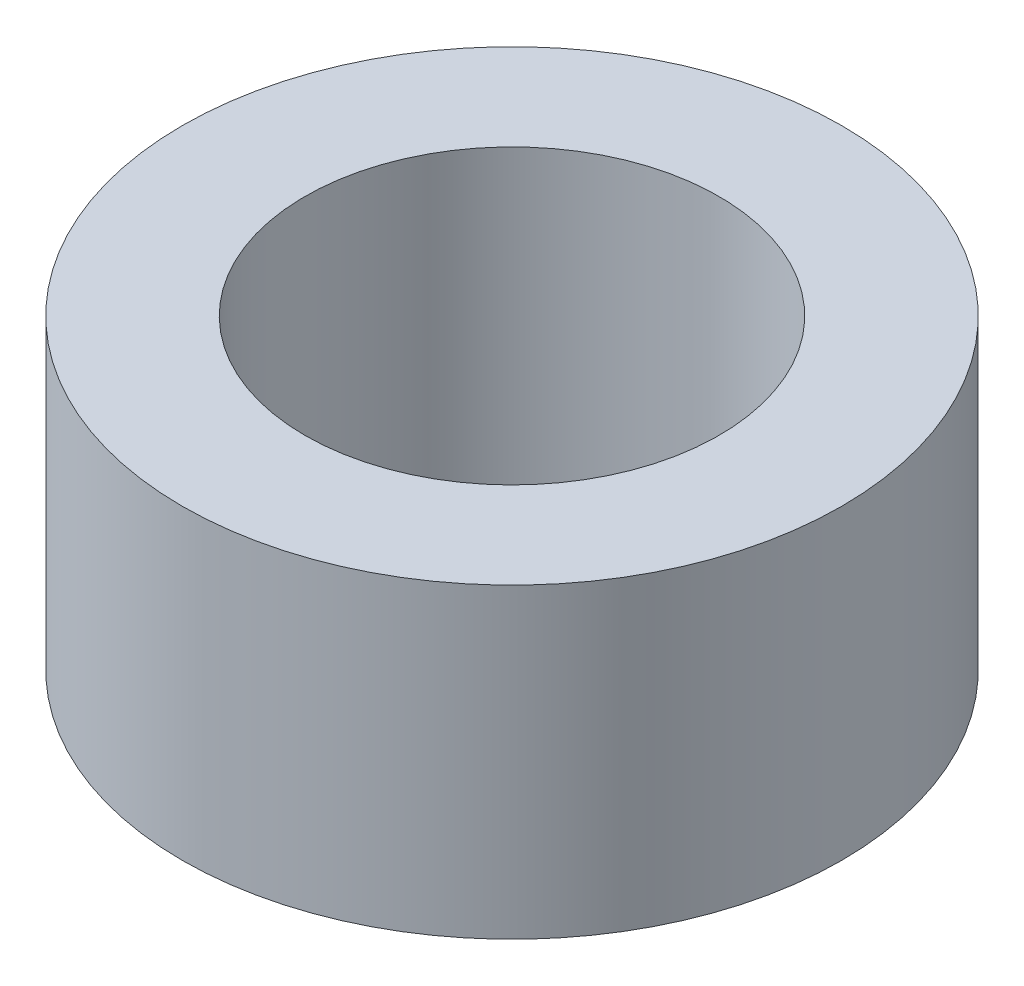
from build123d import *

# Parameters (mm, degrees)
SKETCH1_R           = 5.375
SKETCH1_R_2         = 3.375
BOSS_EXTRUDE1_DEPTH = 5


with BuildPart() as part:
    # Sketch1 → Boss-Extrude1 (new body)
    with BuildSketch(Plane(origin=(0, 0, 0), x_dir=(1, 0, 0), z_dir=(0, 1, 0))):
        with Locations(Location((0, 0, 0), (0, 0, 270))):
            Circle(SKETCH1_R)
        with Locations(Location((0, 0, 0), (0, 0, 270))):
            Circle(SKETCH1_R_2, mode=Mode.SUBTRACT)
    extrude(amount=BOSS_EXTRUDE1_DEPTH)


solid = part.part
